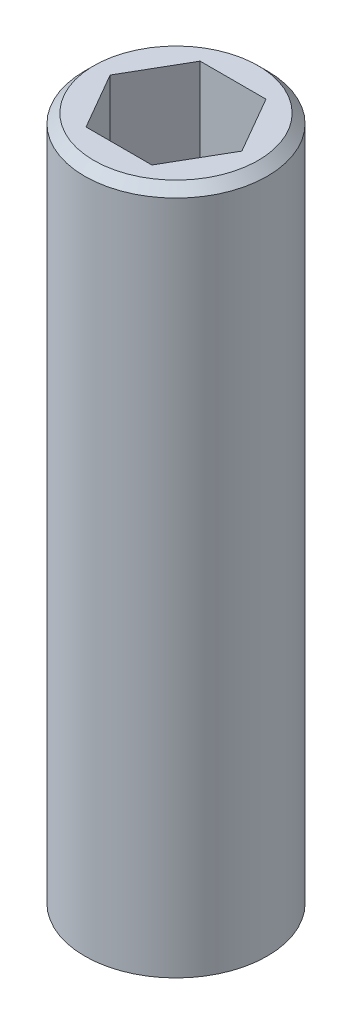
from build123d import *

# Parameters (mm, degrees)
SKETCH1_R           = 2
BOSS_EXTRUDE1_DEPTH = 7.5
CUT_EXTRUDE1_DEPTH  = 2
CHAMFER1_SIZE       = 0.2


with BuildPart() as part:
    # Sketch1 → Boss-Extrude1 (new, symmetric)
    with BuildSketch(Plane(origin=(0, 0, 0), x_dir=(1, 0, 0), z_dir=(0, 1, 0))):
        with Locations(Location((0, 0, 0), (0, 0, 270))):
            Circle(SKETCH1_R)
    extrude(amount=BOSS_EXTRUDE1_DEPTH, both=True)

    # Sketch2 → Cut-Extrude1 (cut)
    with BuildSketch(Plane(origin=(0, 7.5, 0), x_dir=(1, 0, 0), z_dir=(0, 1, 0))):
        Polygon((0.721687836, 1.25), (-0.721687836, 1.25), (-1.443375673, 0), (-0.721687836, -1.25), (0.721687836, -1.25), (1.443375673, 0), align=None)
    extrude(amount=-CUT_EXTRUDE1_DEPTH, mode=Mode.SUBTRACT)

    # Chamfer1
    chamfer1_edges = [part.edges().sort_by_distance(p)[0] for p in [
        (0, 7.5, -2),
    ]]
    chamfer(chamfer1_edges, length=CHAMFER1_SIZE)


solid = part.part
